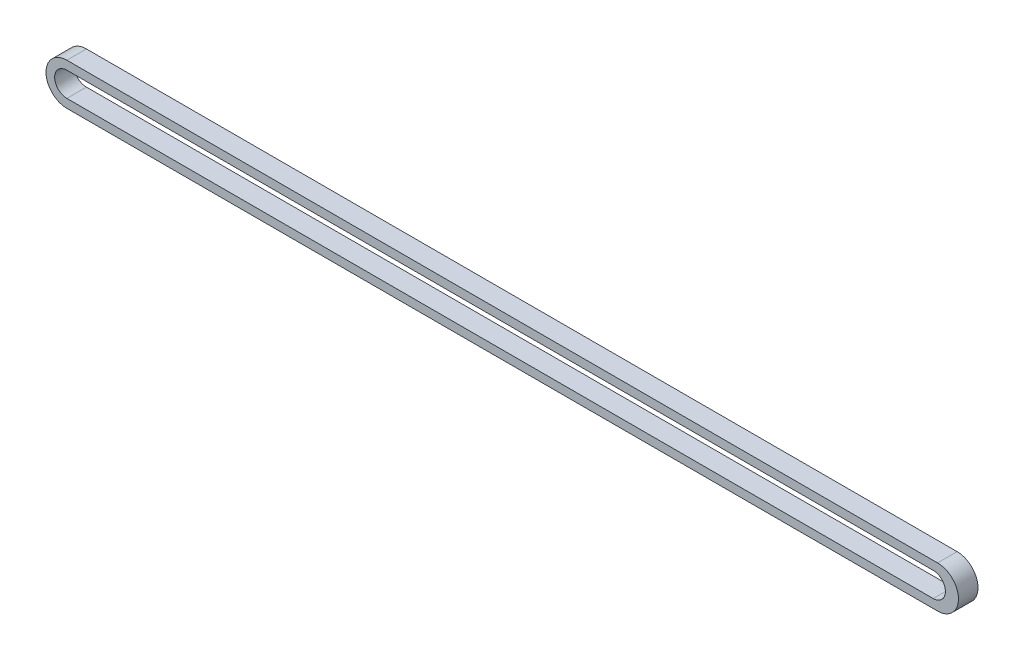
from build123d import *

# Parameters (mm, degrees)
BOSS_EXTRUDE1_DEPTH = 3


with BuildPart() as part:
    # Sketch1 → Boss-Extrude1 (new body)
    with BuildSketch(Plane.XY):
        with BuildLine():
            Line((0, 3.2), (133.6, 3.2))
            ThreePointArc((133.6, 3.2), (136.8, 0), (133.6, -3.2))
            Line((133.6, -3.2), (0, -3.2))
            ThreePointArc((0, -3.2), (-3.2, 0), (0, 3.2))
        make_face()
        with BuildLine():
            Line((0, 1.872), (132.928, 1.872))
            ThreePointArc((132.928, 1.872), (134.8, 0), (132.928, -1.872))
            Line((132.928, -1.872), (0, -1.872))
            ThreePointArc((0, -1.872), (-1.872, 0), (0, 1.872))
        make_face(mode=Mode.SUBTRACT)
    extrude(amount=-BOSS_EXTRUDE1_DEPTH)


solid = part.part
